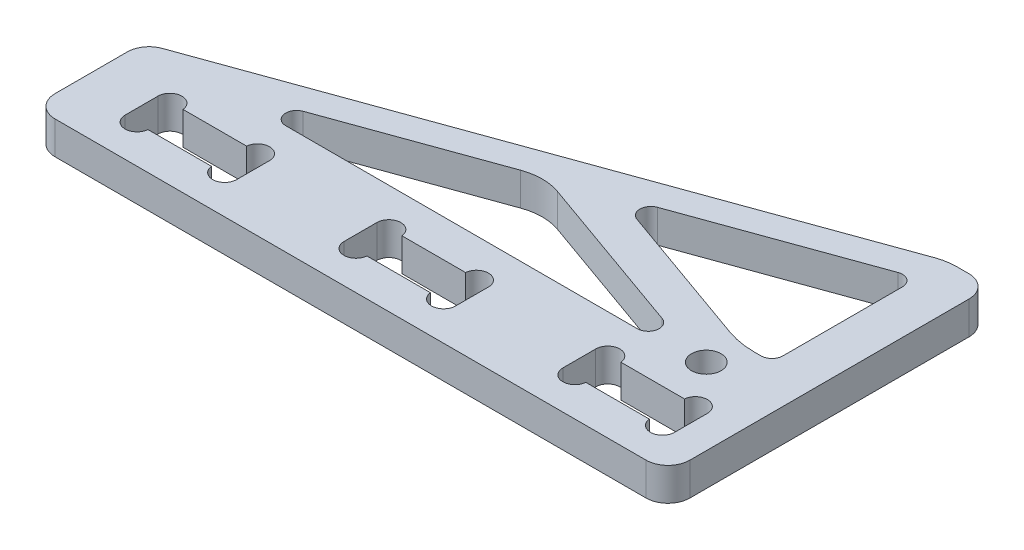
from build123d import *
from OCP.BRepFilletAPI import BRepFilletAPI_MakeFillet

# Parameters (mm, degrees)
SKETCH_1_W          = 58
SKETCH_1_H          = 10
EXTRUDE_1_DEPTH     = 3
SKETCH_3_W          = 10
SKETCH_3_H          = 3
CUT_EXTRUDE_2_DEPTH = 30.580398915
EXTRUDE_2_DEPTH     = 3
SKETCH_5_R          = 1
SKETCH_5_R_2        = 1.35
CUT_EXTRUDE_3_DEPTH = 39.082148049
CUT_EXTRUDE_5_DEPTH = 39.082148049
FILLET_1_R          = 1
FILLET_2_R          = 2
FILLET_3_R1         = 5
FILLET_3_R2         = 8


with BuildPart() as part:
    # 草图1 → 凸台-拉伸1 (new body)
    with BuildSketch(Plane(origin=(0, 0, 0), x_dir=(1, 0, 0), z_dir=(0, 1, 0))):
        Rectangle(SKETCH_1_W, SKETCH_1_H)
    extrude(amount=EXTRUDE_1_DEPTH)

    # 草图3 → 切除-拉伸2 (cut, through all)
    with BuildSketch(Plane.XZ):
        with Locations((-19, 0)):
            Rectangle(SKETCH_3_W, SKETCH_3_H)
        with Locations((1, 0)):
            Rectangle(SKETCH_3_W, SKETCH_3_H)
        with Locations((21, 0)):
            Rectangle(SKETCH_3_W, SKETCH_3_H)
    extrude(amount=-CUT_EXTRUDE_2_DEPTH, mode=Mode.SUBTRACT)

    # 草图9 → 凸台-拉伸2 (add)
    with BuildSketch(Plane(origin=(0, 3, 0), x_dir=(1, 0, 0), z_dir=(0, 1, 0))):
        with BuildLine():
            Line((29, 24.5), (29, 5))
            Line((29, 5), (22, 5))
            Line((22, 5), (16.19691326, 5))
            ThreePointArc((16.19691326, 5), (17.182388504, 5.830180852), (16.531618392, 6.942322914))
            Line((16.531618392, 6.942322914), (0, 12.814213999))
            Line((0, 12.814213999), (-21.639361843, 5))
            Line((-21.639361843, 5), (-29, 5))
            Line((-29, 5), (25, 24.5))
            Line((25, 24.5), (29, 24.5))
        make_face()
        Polygon((25, 21.841991777), (25, 8.5), (22, 8.5), (4.886202736, 14.578676098), align=None, mode=Mode.SUBTRACT)
    extrude(amount=-EXTRUDE_2_DEPTH)

    # 草图5 → 切除-拉伸3 (cut, through all)
    with BuildSketch(Plane.XZ):
        with Locations((-23, 1.5)):
            Circle(SKETCH_5_R)
        with Locations((-15, 1.5)):
            Circle(SKETCH_5_R)
        with Locations((-15, -1.5)):
            Circle(SKETCH_5_R)
        with Locations((-23, -1.5)):
            Circle(SKETCH_5_R)
        with Locations((-3, -1.5)):
            Circle(SKETCH_5_R)
        with Locations((5, -1.5)):
            Circle(SKETCH_5_R)
        with Locations((-3, 1.5)):
            Circle(SKETCH_5_R)
        with Locations((5, 1.5)):
            Circle(SKETCH_5_R)
        with Locations(Location((22, -5.5, 0), (0, 0, 270))):
            Circle(SKETCH_5_R_2)
        with Locations((25, -1.5)):
            Circle(SKETCH_5_R)
        with Locations((17, -1.5)):
            Circle(SKETCH_5_R)
        with Locations((17, 1.5)):
            Circle(SKETCH_5_R)
        with Locations((25, 1.5)):
            Circle(SKETCH_5_R)
    extrude(amount=-CUT_EXTRUDE_3_DEPTH, mode=Mode.SUBTRACT)

    # 草图8 → 切除-拉伸5 (cut, through all)
    with BuildSketch(Plane(origin=(0, 3, 0), x_dir=(1, 0, 0), z_dir=(0, 1, 0))):
        with BuildLine():
            Line((6.1, -1.5), (6.1, 1.5))
            ThreePointArc((6.1, 1.5), (5.050051841, 2.598860689), (3.904554885, 1.6))
            Line((3.904554885, 1.6), (-1.904554885, 1.6))
            ThreePointArc((-1.904554885, 1.6), (-3.050051841, 2.598860689), (-4.1, 1.5))
            Line((-4.1, 1.5), (-4.1, -1.5))
            ThreePointArc((-4.1, -1.5), (-3.050051841, -2.598860689), (-1.904554885, -1.6))
            Line((-1.904554885, -1.6), (3.904554885, -1.6))
            ThreePointArc((3.904554885, -1.6), (5.050051841, -2.598860689), (6.1, -1.5))
        make_face()
        with BuildLine():
            Line((-16.095445115, -1.6), (-21.904554885, -1.6))
            ThreePointArc((-21.904554885, -1.6), (-23.050051841, -2.598860689), (-24.1, -1.5))
            Line((-24.1, -1.5), (-24.1, 1.5))
            ThreePointArc((-24.1, 1.5), (-23.050051841, 2.598860689), (-21.904554885, 1.6))
            Line((-21.904554885, 1.6), (-16.095445115, 1.6))
            ThreePointArc((-16.095445115, 1.6), (-14.949948159, 2.598860689), (-13.9, 1.5))
            Line((-13.9, 1.5), (-13.9, -1.5))
            ThreePointArc((-13.9, -1.5), (-14.949948159, -2.598860689), (-16.095445115, -1.6))
        make_face()
        with BuildLine():
            Line((23.904554885, -1.6), (18.095445115, -1.6))
            ThreePointArc((18.095445115, -1.6), (16.949948159, -2.598860689), (15.9, -1.5))
            Line((15.9, -1.5), (15.9, 1.5))
            ThreePointArc((15.9, 1.5), (16.949948159, 2.598860689), (18.095445115, 1.6))
            Line((18.095445115, 1.6), (23.904554885, 1.6))
            ThreePointArc((23.904554885, 1.6), (25.050051841, 2.598860689), (26.1, 1.5))
            Line((26.1, 1.5), (26.1, -1.5))
            ThreePointArc((26.1, -1.5), (25.050051841, -2.598860689), (23.904554885, -1.6))
        make_face()
    extrude(amount=-CUT_EXTRUDE_5_DEPTH, mode=Mode.SUBTRACT)

    # 圆角1
    fillet_1_edges = [part.edges().sort_by_distance(p)[0] for p in [
        (-21.639361843, 1.5, -5),
        (25, 1.5, -21.841991777),
        (25, 1.5, -8.5),
        (4.886202736, 1.5, -14.578676098),
    ]]
    fillet(fillet_1_edges, radius=FILLET_1_R)

    # 圆角2
    fillet_2_edges = [part.edges().sort_by_distance(p)[0] for p in [
        (29, 1.5, -24.5),
        (29, 1.5, 5),
        (-29, 1.5, 5),
        (-29, 1.5, -5),
    ]]
    fillet(fillet_2_edges, radius=FILLET_2_R)

    # 圆角3: one fillet with a radius per group of edges: ONE call of the kernel's fillet builder (fillet() takes one radius for all edges)
    fillet_3_edges_1 = [part.edges().sort_by_distance(p)[0] for p in [
        (0, 1.5, -12.814213999),
        (25, 1.5, -24.5),
    ]]
    fillet_3_edges_2 = [part.edges().sort_by_distance(p)[0] for p in [
        (22, 1.5, -8.5),
    ]]
    fillet_3 = BRepFilletAPI_MakeFillet(part.part.solid().wrapped)
    for e in fillet_3_edges_1:
        fillet_3.Add(FILLET_3_R1, e.wrapped)
    for e in fillet_3_edges_2:
        fillet_3.Add(FILLET_3_R2, e.wrapped)
    add(Compound.cast(fillet_3.Shape()), mode=Mode.REPLACE)


solid = part.part
